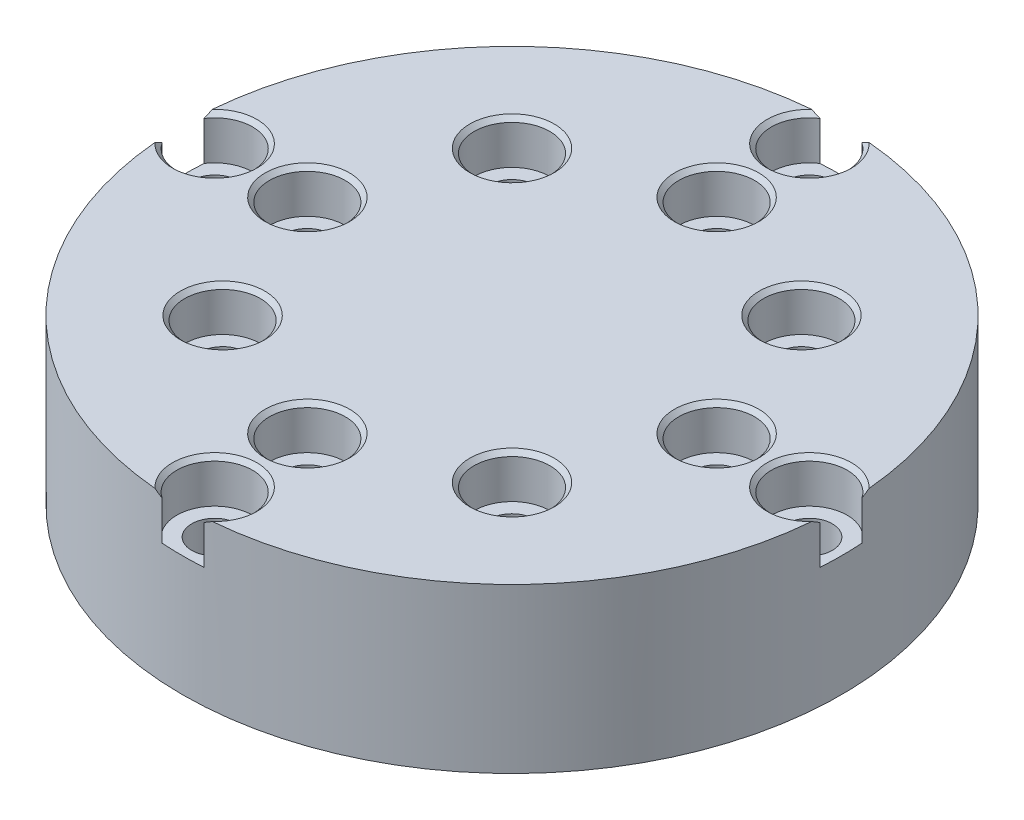
from build123d import *

# Parameters (mm, degrees)
SKETCH1_R                                     = 48.312804733
BOSS_EXTRUDE1_DEPTH                           = 24
CBORE_FOR_1_4_SOCKET_HEAD_CAP_SCREW2_AT_COUNT = 2
CBORE_FOR_1_4_SOCKET_HEAD_CAP_SCREW2_AT_PITCH = 61.636013361
CBORE_FOR_1_4_SOCKET_HEAD_CAP_SCREW2_2_COUNT  = 2
CBORE_FOR_1_4_SOCKET_HEAD_CAP_SCREW2_2_PITCH  = 87.166486026
CBORE_FOR_1_4_SOCKET_HEAD_CAP_SCREW2_3_COUNT  = 2
CBORE_FOR_1_4_SOCKET_HEAD_CAP_SCREW2_3_PITCH  = 61.636013361
CIRPATTERN1_COUNT                             = 8


with BuildPart() as part:
    # Sketch1 → Boss-Extrude1 (new body)
    with BuildSketch(Plane(origin=(0, 0, 0), x_dir=(1, 0, 0), z_dir=(0, 1, 0))):
        with Locations(Location((0, 0, 0), (0, 0, 270))):
            Circle(SKETCH1_R)
    extrude(amount=BOSS_EXTRUDE1_DEPTH)

    # Sketch8 → CBORE for 1/4 Socket Head Cap Screw2 (revolve, cut)
    with BuildSketch(Plane(origin=(0, 24, -43.583243013), x_dir=(0, 0, 1), z_dir=(1, 0, 0))):
        Polygon((0, 0), (0, 24), (3.3782, 24), (3.3782, 6.35), (5.55625, 6.35), (5.55625, 0.635), (6.19125, 0), align=None)
    cbore_for_1_4_socket_head_cap_screw2 = revolve(axis=Axis((0, 30.35, -43.583243013), (0, -1, 0)), mode=Mode.SUBTRACT)

    # CBORE for 1/4 Socket Head Cap Screw2 at: CBORE for 1/4 Socket Head Cap Screw2 ×2
    with Locations(*[Vector(-0.7071067811865476, 0, 0.7071067811865476) * (i * CBORE_FOR_1_4_SOCKET_HEAD_CAP_SCREW2_AT_PITCH) for i in range(1, CBORE_FOR_1_4_SOCKET_HEAD_CAP_SCREW2_AT_COUNT)]):
        add(cbore_for_1_4_socket_head_cap_screw2, mode=Mode.SUBTRACT)

    # CBORE for 1_4 Socket Head Cap Screw2 2: CBORE for 1/4 Socket Head Cap Screw2 ×2
    with Locations(*[(0, 0, i * CBORE_FOR_1_4_SOCKET_HEAD_CAP_SCREW2_2_PITCH) for i in range(1, CBORE_FOR_1_4_SOCKET_HEAD_CAP_SCREW2_2_COUNT)]):
        add(cbore_for_1_4_socket_head_cap_screw2, mode=Mode.SUBTRACT)

    # CBORE for 1_4 Socket Head Cap Screw2 3: CBORE for 1/4 Socket Head Cap Screw2 ×2
    with Locations(*[Vector(0.7071067811865476, 0, 0.7071067811865476) * (i * CBORE_FOR_1_4_SOCKET_HEAD_CAP_SCREW2_3_PITCH) for i in range(1, CBORE_FOR_1_4_SOCKET_HEAD_CAP_SCREW2_3_COUNT)]):
        add(cbore_for_1_4_socket_head_cap_screw2, mode=Mode.SUBTRACT)

    # Sketch10 → CBORE for 1/4 Socket Head Cap Screw3 (revolve, cut)
    with BuildSketch(Plane(origin=(30, 24, 0), x_dir=(0, 0, 1), z_dir=(1, 0, 0))):
        Polygon((0, 0), (0, 24), (3.3782, 24), (3.3782, 6.35), (5.55625, 6.35), (5.55625, 0.635), (6.19125, 0), align=None)
    cbore_for_1_4_socket_head_cap_screw3 = revolve(axis=Axis((30, 30.35, 0), (0, -1, 0)), mode=Mode.SUBTRACT)

    # CirPattern1: CBORE for 1/4 Socket Head Cap Screw3 ×8 about axis
    cirpattern1_axis = Axis((0, 0, 0), (0, 1, 0))
    for i in range(1, CIRPATTERN1_COUNT):
        add(cbore_for_1_4_socket_head_cap_screw3.rotate(cirpattern1_axis, i * 360 / CIRPATTERN1_COUNT), mode=Mode.SUBTRACT)


solid = part.part
